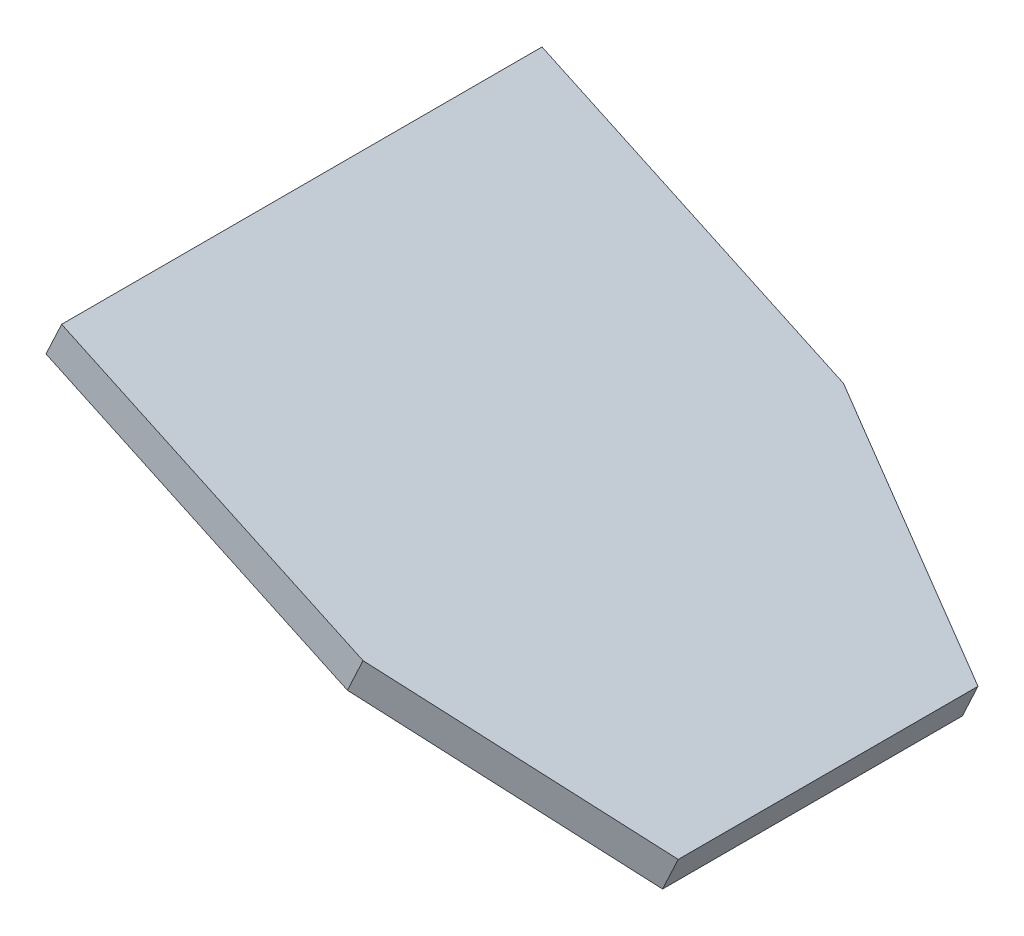
from build123d import *

# Parameters (mm, degrees)
BOSS_EXTRUDE1_DEPTH      = 10
BOSS_EXTRUDE1_DEPTH_BACK = 10
BOSS_EXTRUDE2_DEPTH      = 10
SKETCH3_W                = 150
SKETCH3_H                = 20
BOSS_EXTRUDE3_DEPTH      = 10


with BuildPart() as part:
    # Sketch1 → Boss-Extrude1 (new, two sides: drawn at the far end of the back side and taken through both)
    with BuildSketch(Plane.XY.offset(-BOSS_EXTRUDE1_DEPTH_BACK)):
        Polygon((0, 0), (150, 0), (14.053831945, 63.392739261), align=None)
    extrude(amount=BOSS_EXTRUDE1_DEPTH + BOSS_EXTRUDE1_DEPTH_BACK)



with BuildPart() as body_2:
    # Sketch2 → Boss-Extrude2 (new body)
    with BuildSketch(Plane(origin=(26.790929274, 57.453333234, 0), x_dir=(0.9063077870366495, -0.42261826174070033, 0), z_dir=(0.42261826174070033, 0.9063077870366495, 0))):
        Polygon((68.803496006, 65.613486746), (-21.196503994, 65.613486746), (-21.196503994, -64.386513254), (68.803496006, -64.386513254), (135.946168055, -39.948579179), (135.946168055, -10), (-14.053831945, -10), (-14.053831945, 10), (135.946168055, 10), (135.946168055, 41.175552671), align=None)
    extrude(amount=BOSS_EXTRUDE2_DEPTH)


with BuildPart() as part_1:
    add(part.part)

    add(body_2.part)  # Boss-Extrude3 merges body 2
    # Sketch3 → Boss-Extrude3 (add)
    with BuildSketch(Plane(origin=(26.790929274, 57.453333234, 0), x_dir=(0.9063077870366495, -0.42261826174070033, 0), z_dir=(0.42261826174070033, 0.9063077870366495, 0))):
        with Locations((60.946168055, 0)):
            Rectangle(SKETCH3_W, SKETCH3_H)
    extrude(amount=BOSS_EXTRUDE3_DEPTH)


solid = part_1.part
